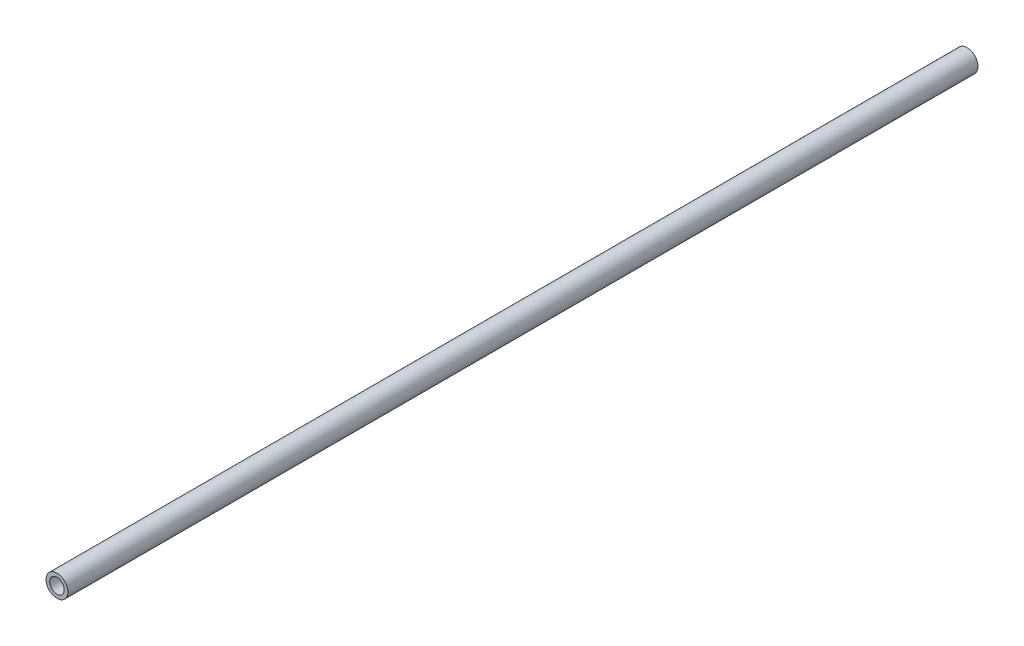
from build123d import *

# Parameters (mm, degrees)
ESQUISSE1_R        = 3
ESQUISSE1_R_2      = 2
EXTRU_MINCE1_DEPTH = 249.5


with BuildPart() as part:
    # Esquisse1 → Extru.-Mince1 (new body)
    with BuildSketch(Plane.XY):
        Circle(ESQUISSE1_R)
        Circle(ESQUISSE1_R_2, mode=Mode.SUBTRACT)
    extrude(amount=EXTRU_MINCE1_DEPTH)


solid = part.part
